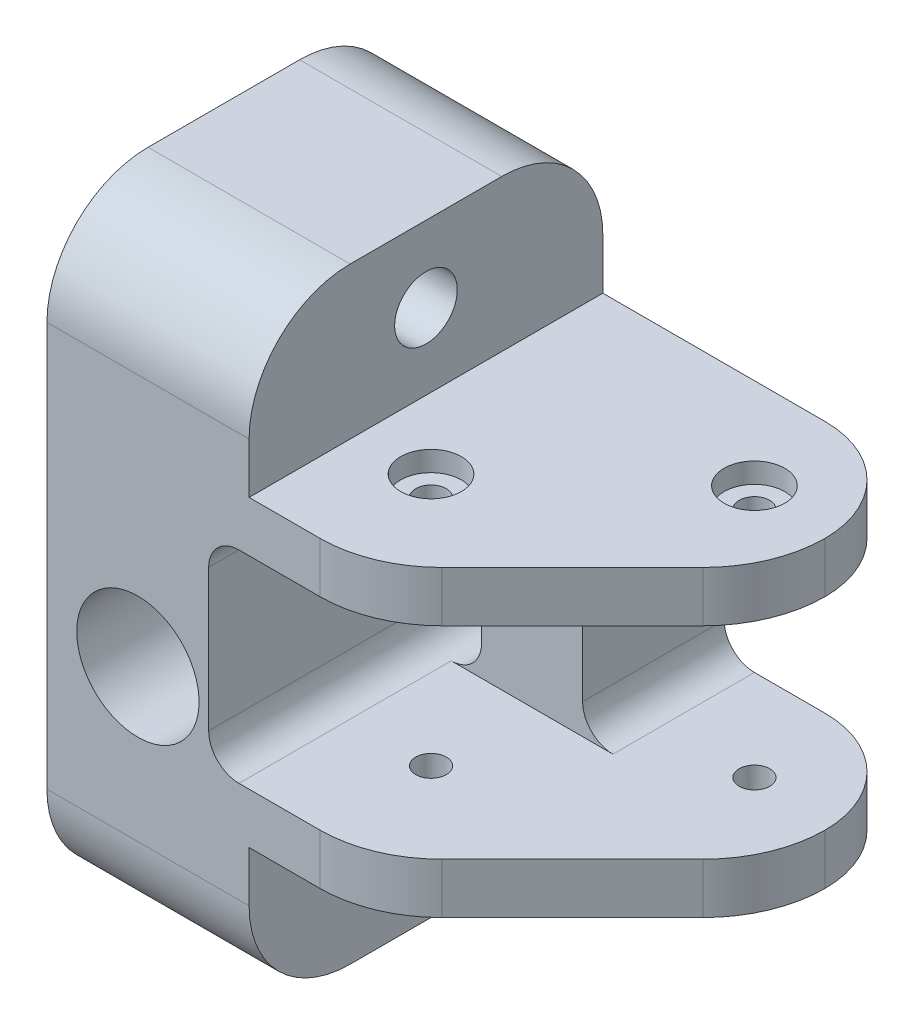
from build123d import *

# Parameters (mm, degrees)
EXTRUDE_1_DEPTH      = 60
SKETCH_2_W           = 32
SKETCH_2_H           = 15
CUT_EXTRUDE_1_DEPTH  = 60
SKETCH_3_R           = 3
CUT_EXTRUDE_2_DEPTH  = 30
CUT_EXTRUDE_3_DEPTH  = 30
CUT_EXTRUDE_4_DEPTH  = 50
SKETCH_6_R           = 5
CUT_EXTRUDE_5_DEPTH  = 50
CUT_EXTRUDE_6_DEPTH  = 50
SKETCH_8_W           = 21
SKETCH_8_H           = 14
SKETCH_8_H_2         = 3
CUT_EXTRUDE_7_DEPTH  = 13
SKETCH_9_W           = 21
SKETCH_9_H           = 3
CUT_EXTRUDE_8_DEPTH  = 13
CUT_EXTRUDE_10_DEPTH = 50
CUT_EXTRUDE_11_DEPTH = 50
SKETCH_15_R          = 1.51
CUT_EXTRUDE_14_DEPTH = 100
CUT_EXTRUDE_START    = -100
SKETCH_16_R          = 1.51
CUT_EXTRUDE_15_DEPTH = 100
SKETCH_17_R          = 1.51
CUT_EXTRUDE_16_DEPTH = 100
SKETCH_18_R          = 1.51
CUT_EXTRUDE_17_DEPTH = 100
SKETCH_21_R          = 3
CUT_EXTRUDE_18_DEPTH = 2
CUT_EXTRUDE_START_2  = -2
SKETCH_22_R          = 3
CUT_EXTRUDE_19_DEPTH = 2
SKETCH_23_R          = 5.05
CUT_EXTRUDE_20_DEPTH = 100
SKETCH_24_R          = 3.05
CUT_EXTRUDE_21_DEPTH = 100
SKETCH_25_R          = 3.05
CUT_EXTRUDE_22_DEPTH = 30
SKETCH_27_R          = 6.05
CUT_EXTRUDE_23_DEPTH = 50
EXTRUDE_START        = 2
SKETCH_29_R          = 3.05
EXTRUDE_2_DEPTH      = 2
SKETCH_30_R          = 3.1
CUT_EXTRUDE_24_DEPTH = 30


with BuildPart() as part:
    # 草图1 → 凸台-拉伸1 (new body)
    with BuildSketch(Plane(origin=(0, 0, 0), x_dir=(1, 0, 0), z_dir=(0, 1, 0))):
        Polygon((-25, -17.5), (5, -17.5), (25, 2.5), (25, 17.5), (-25, 17.5), align=None)
    extrude(amount=EXTRUDE_1_DEPTH)

    # 草图2 → 切除-拉伸1 (cut)
    with BuildSketch(Plane(origin=(0, 0, -17.5), x_dir=(-1, 0, 0), z_dir=(0, 0, -1))):
        with Locations((-9, 52.5)):
            Rectangle(SKETCH_2_W, SKETCH_2_H)
        with Locations((-9, 7.5)):
            Rectangle(SKETCH_2_W, SKETCH_2_H)
    extrude(amount=-CUT_EXTRUDE_1_DEPTH, mode=Mode.SUBTRACT)

    # 草图3 → 切除-拉伸2 (cut)
    with BuildSketch(Plane.ZY.offset(25)):
        with Locations((0, 52.5)):
            Circle(SKETCH_3_R)
        with Locations((0, 7.5)):
            Circle(SKETCH_3_R)
    extrude(amount=-CUT_EXTRUDE_2_DEPTH, mode=Mode.SUBTRACT)

    # 草图4 → 切除-拉伸3 (cut)
    with BuildSketch(Plane.ZY.offset(25)):
        with BuildLine():
            Line((-7.5, 60), (-17.5, 60))
            Line((-17.5, 60), (-17.5, 50))
            ThreePointArc((-17.5, 50), (-14.571067812, 57.071067812), (-7.5, 60))
        make_face()
        with BuildLine():
            Line((17.5, 60), (7.5, 60))
            ThreePointArc((7.5, 60), (14.571067812, 57.071067812), (17.5, 50))
            Line((17.5, 50), (17.5, 60))
        make_face()
        with BuildLine():
            Line((17.5, 0), (17.5, 10))
            ThreePointArc((17.5, 10), (14.571067812, 2.928932188), (7.5, 0))
            Line((7.5, 0), (17.5, 0))
        make_face()
        with BuildLine():
            ThreePointArc((-7.5, 0), (-14.571067812, 2.928932188), (-17.5, 10))
            Line((-17.5, 10), (-17.5, 0))
            Line((-17.5, 0), (-7.5, 0))
        make_face()
    extrude(amount=-CUT_EXTRUDE_3_DEPTH, mode=Mode.SUBTRACT)

    # 草图5 → 切除-拉伸4 (cut)
    with BuildSketch(Plane(origin=(0, 0, -17.5), x_dir=(-1, 0, 0), z_dir=(0, 0, -1))):
        with BuildLine():
            Line((5, 37), (5, 23))
            ThreePointArc((5, 23), (8, 20), (11, 23))
            Line((11, 23), (11, 37))
            ThreePointArc((11, 37), (8, 40), (5, 37))
        make_face()
    extrude(amount=-CUT_EXTRUDE_4_DEPTH, mode=Mode.SUBTRACT)

    # 草图6 → 切除-拉伸5 (cut)
    with BuildSketch(Plane(origin=(0, 0, -17.5), x_dir=(-1, 0, 0), z_dir=(0, 0, -1))):
        with Locations((18, 25)):
            Circle(SKETCH_6_R)
    extrude(amount=-CUT_EXTRUDE_5_DEPTH, mode=Mode.SUBTRACT)

    # 草图7 → 切除-拉伸6 (cut)
    with BuildSketch(Plane(origin=(0, 0, -17.5), x_dir=(-1, 0, 0), z_dir=(0, 0, -1))):
        with BuildLine():
            ThreePointArc((-5, 37), (-5.878679656, 39.121320344), (-8, 40))
            Line((-8, 40), (-25, 40))
            Line((-25, 40), (-25, 20))
            Line((-25, 20), (-8, 20))
            ThreePointArc((-8, 20), (-5.878679656, 20.878679656), (-5, 23))
            Line((-5, 23), (-5, 30))
            Line((-5, 30), (-5, 37))
        make_face()
    extrude(amount=-CUT_EXTRUDE_6_DEPTH, mode=Mode.SUBTRACT)

    # 草图8 → 切除-拉伸7 (cut)
    with BuildSketch(Plane(origin=(5, 0, 0), x_dir=(0, 0, -1), z_dir=(1, 0, 0))):
        with Locations((-7, 30)):
            Rectangle(SKETCH_8_W, SKETCH_8_H)
        with Locations((-7, 38.5)):
            Rectangle(SKETCH_8_W, SKETCH_8_H_2)
        with Locations((-7, 21.5)):
            Rectangle(SKETCH_8_W, SKETCH_8_H_2)
    extrude(amount=-CUT_EXTRUDE_7_DEPTH, mode=Mode.SUBTRACT)

    # 草图9 → 切除-拉伸8 (cut)
    with BuildSketch(Plane.ZY.offset(-5)):
        with Locations((7, 38.5)):
            Rectangle(SKETCH_9_W, SKETCH_9_H)
        with Locations((7, 21.5)):
            Rectangle(SKETCH_9_W, SKETCH_9_H)
    extrude(amount=-CUT_EXTRUDE_8_DEPTH, mode=Mode.SUBTRACT)

    # 草图10 → 切除-拉伸10 (cut)
    with BuildSketch(Plane(origin=(0, 15, 0), x_dir=(-1, 0, 0), z_dir=(0, -1, 0))):
        with BuildLine():
            Line((-25, 17.5), (-25, 7.5))
            ThreePointArc((-25, 7.5), (-22.071067812, 14.571067812), (-15, 17.5))
            Line((-15, 17.5), (-25, 17.5))
        make_face()
        with BuildLine():
            Line((-25, 2.5), (-25, 7.5))
            ThreePointArc((-25, 7.5), (-24.081144675, 2.880602337), (-21.464466094, -1.035533906))
            Line((-21.464466094, -1.035533906), (-25, 2.5))
        make_face()
    extrude(amount=-CUT_EXTRUDE_10_DEPTH, mode=Mode.SUBTRACT)

    # 草图11 → 切除-拉伸11 (cut)
    with BuildSketch(Plane(origin=(0, 45, 0), x_dir=(1, 0, 0), z_dir=(0, 1, 0))):
        with BuildLine():
            Line((5, -17.5), (8.535533906, -13.964466094))
            ThreePointArc((8.535533906, -13.964466094), (4.619397663, -16.581144675), (0, -17.5))
            Line((0, -17.5), (5, -17.5))
        make_face()
    extrude(amount=-CUT_EXTRUDE_11_DEPTH, mode=Mode.SUBTRACT)

    # 草图15 → 切除-拉伸14 (cut)
    with BuildSketch(Plane(origin=(0, 20, 0), x_dir=(1, 0, 0), z_dir=(0, 1, 0))):
        with Locations(Location((17, 8.5, 0), (0, 0, 270))):
            Circle(SKETCH_15_R)
    extrude(amount=-CUT_EXTRUDE_14_DEPTH, mode=Mode.SUBTRACT)

    # 草图16 → 切除-拉伸15 (cut)
    with BuildSketch(Plane.XZ.offset(-15).offset(CUT_EXTRUDE_START)):
        with Locations(Location((17, -8.5, 0), (0, 0, 90))):
            Circle(SKETCH_16_R)
    extrude(amount=CUT_EXTRUDE_15_DEPTH, mode=Mode.SUBTRACT)

    # 草图17 → 切除-拉伸16 (cut)
    with BuildSketch(Plane(origin=(0, 40, 0), x_dir=(-1, 0, 0), z_dir=(0, -1, 0))):
        with Locations(Location((0, -6.5, 0), (0, 0, 90))):
            Circle(SKETCH_17_R)
    extrude(amount=-CUT_EXTRUDE_16_DEPTH, mode=Mode.SUBTRACT)

    # 草图18 → 切除-拉伸17 (cut)
    with BuildSketch(Plane(origin=(0, 45, 0), x_dir=(1, 0, 0), z_dir=(0, 1, 0)).offset(CUT_EXTRUDE_START)):
        with Locations(Location((0, -6.5, 0), (0, 0, 90))):
            Circle(SKETCH_18_R)
    extrude(amount=CUT_EXTRUDE_17_DEPTH, mode=Mode.SUBTRACT)

    # 草图21 → 切除-拉伸18 (cut)
    with BuildSketch(Plane(origin=(0, 45, 0), x_dir=(1, 0, 0), z_dir=(0, 1, 0))):
        with Locations(Location((0, -6.5, 0), (0, 0, 270))):
            Circle(SKETCH_21_R)
        with Locations(Location((17, 8.5, 0), (0, 0, 270))):
            Circle(SKETCH_21_R)
    extrude(amount=-CUT_EXTRUDE_18_DEPTH, mode=Mode.SUBTRACT)

    # 草图22 → 切除-拉伸19 (cut)
    with BuildSketch(Plane(origin=(0, 15, 0), x_dir=(-1, 0, 0), z_dir=(0, -1, 0)).offset(CUT_EXTRUDE_START_2)):
        with Locations(Location((0, -6.5, 0), (0, 0, 270))):
            Circle(SKETCH_22_R)
        with Locations(Location((-17, 8.5, 0), (0, 0, 270))):
            Circle(SKETCH_22_R)
    extrude(amount=CUT_EXTRUDE_19_DEPTH, mode=Mode.SUBTRACT)

    # 草图23 → 切除-拉伸20 (cut)
    with BuildSketch(Plane(origin=(0, 0, -17.5), x_dir=(-1, 0, 0), z_dir=(0, 0, -1))):
        with Locations((18, 25)):
            Circle(SKETCH_23_R)
    extrude(amount=-CUT_EXTRUDE_20_DEPTH, mode=Mode.SUBTRACT)

    # 草图24 → 切除-拉伸21 (cut)
    with BuildSketch(Plane.ZY.offset(25)):
        with Locations((0, 52.5)):
            Circle(SKETCH_24_R)
    extrude(amount=-CUT_EXTRUDE_21_DEPTH, mode=Mode.SUBTRACT)

    # 草图25 → 切除-拉伸22 (cut)
    with BuildSketch(Plane.ZY.offset(25)):
        with Locations((0, 7.5)):
            Circle(SKETCH_25_R)
    extrude(amount=-CUT_EXTRUDE_22_DEPTH, mode=Mode.SUBTRACT)

    # 草图27 → 切除-拉伸23 (cut)
    with BuildSketch(Plane(origin=(0, 0, -17.5), x_dir=(-1, 0, 0), z_dir=(0, 0, -1))):
        with Locations((18, 25)):
            Circle(SKETCH_27_R)
    extrude(amount=-CUT_EXTRUDE_23_DEPTH, mode=Mode.SUBTRACT)

    # 草图29 → 凸台-拉伸2 (add)
    with BuildSketch(Plane.ZY.offset(25).offset(EXTRUDE_START)):
        with BuildLine():
            Line((-7.5, 60), (7.5, 60))
            ThreePointArc((7.5, 60), (14.571067812, 57.071067812), (17.5, 50))
            Line((17.5, 50), (17.5, 10))
            ThreePointArc((17.5, 10), (14.571067812, 2.928932188), (7.5, 0))
            Line((7.5, 0), (-7.5, 0))
            ThreePointArc((-7.5, 0), (-14.571067812, 2.928932188), (-17.5, 10))
            Line((-17.5, 10), (-17.5, 50))
            ThreePointArc((-17.5, 50), (-14.571067812, 57.071067812), (-7.5, 60))
        make_face()
        with Locations((0, 52.5)):
            Circle(SKETCH_29_R, mode=Mode.SUBTRACT)
        with Locations((0, 7.5)):
            Circle(SKETCH_29_R, mode=Mode.SUBTRACT)
    extrude(amount=-EXTRUDE_2_DEPTH)

    # 草图30 → 切除-拉伸24 (cut)
    with BuildSketch(Plane.ZY.offset(27)):
        with Locations((0, 52.5)):
            Circle(SKETCH_30_R)
        with Locations((0, 7.5)):
            Circle(SKETCH_30_R)
    extrude(amount=-CUT_EXTRUDE_24_DEPTH, mode=Mode.SUBTRACT)


solid = part.part
